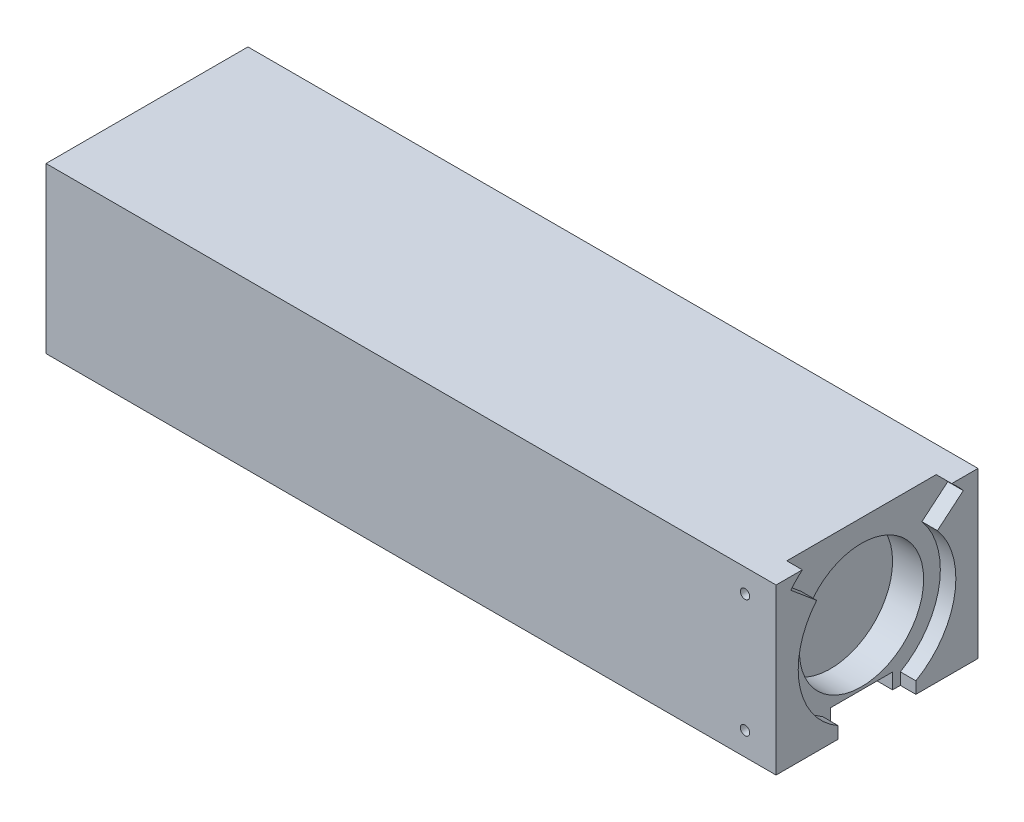
from build123d import *

# Parameters (mm, degrees)
SKETCH_1_W           = 94
SKETCH_1_H           = 26
EXTRUDE_1_DEPTH      = 21.2
SKETCH_1_7_R         = 0.7
CUT_EXTRUDE_1_DEPTH  = 3
SKETCH_2_W           = 77.9
SKETCH_2_H           = 21.4
CUT_EXTRUDE_2_DEPTH  = 19.3
SKETCH_5_W           = 5.5
SKETCH_5_H           = 8
CUT_EXTRUDE_3_DEPTH  = 2
SKETCH_6_W           = 76
SKETCH_6_H           = 24
CUT_EXTRUDE_4_DEPTH  = 3
SKETCH_7_R           = 10.15
SKETCH_7_W           = 10
SKETCH_7_H           = 1.516965414
CUT_EXTRUDE_5_DEPTH  = 2
SKETCH_8_R           = 8
CUT_EXTRUDE_6_DEPTH  = 4
CUT_EXTRUDE_12_DEPTH = 2
SKETCH_10_R          = 0.6
CUT_EXTRUDE_13_DEPTH = 3
CUT_EXTRUDE_START    = -23
SKETCH_10_3_R        = 0.6
CUT_EXTRUDE_14_DEPTH = 3
SKETCH_11_W          = 2.5
SKETCH_11_H          = 11
CUT_EXTRUDE_15_DEPTH = 3
SKETCH_12_R          = 0.3
CUT_EXTRUDE_16_DEPTH = 3
SKETCH_13_W          = 12
SKETCH_13_H          = 3
CUT_EXTRUDE_17_DEPTH = 11


with BuildPart() as part:
    # 草图1 → 凸台-拉伸1 (new body)
    with BuildSketch(Plane(origin=(0, 0, 0), x_dir=(1, 0, 0), z_dir=(0, 1, 0))):
        Rectangle(SKETCH_1_W, SKETCH_1_H)
    extrude(amount=EXTRUDE_1_DEPTH)

    # 草图1<7> → 切除-拉伸1 (cut)
    with BuildSketch(Plane(origin=(0, 0, 0), x_dir=(1, 0, 0), z_dir=(0, 1, 0))):
        with Locations(Location((-44, 10, 0), (0, 0, 270))):
            Circle(SKETCH_1_7_R)
        with Locations(Location((-44, -10, 0), (0, 0, 270))):
            Circle(SKETCH_1_7_R)
        with Locations(Location((44, 10, 0), (0, 0, 270))):
            Circle(SKETCH_1_7_R)
        with Locations(Location((44, -10, 0), (0, 0, 270))):
            Circle(SKETCH_1_7_R)
    extrude(amount=CUT_EXTRUDE_1_DEPTH, mode=Mode.SUBTRACT)

    # 草图2 → 切除-拉伸2 (cut)
    with BuildSketch(Plane.XZ):
        with Locations((1.95, 0)):
            Rectangle(SKETCH_2_W, SKETCH_2_H)
    extrude(amount=-CUT_EXTRUDE_2_DEPTH, mode=Mode.SUBTRACT)

    # 草图5 → 切除-拉伸3 (cut)
    with BuildSketch(Plane.XZ):
        with Locations((-39.75, 0)):
            Rectangle(SKETCH_5_W, SKETCH_5_H)
        with Locations((43.65, 0)):
            Rectangle(SKETCH_5_W, SKETCH_5_H)
    extrude(amount=-CUT_EXTRUDE_3_DEPTH, mode=Mode.SUBTRACT)

    # 草图6 → 切除-拉伸4 (cut)
    with BuildSketch(Plane.XZ):
        with Locations((2, 0)):
            Rectangle(SKETCH_6_W, SKETCH_6_H)
    extrude(amount=-CUT_EXTRUDE_4_DEPTH, mode=Mode.SUBTRACT)

    # 草图7 → 切除-拉伸5 (cut)
    with BuildSketch(Plane(origin=(47, 0, 0), x_dir=(0, 0, -1), z_dir=(1, 0, 0))):
        with Locations((0, 10.35)):
            Circle(SKETCH_7_R)
        with Locations((0, 0.758482707)):
            Rectangle(SKETCH_7_W, SKETCH_7_H)
    extrude(amount=-CUT_EXTRUDE_5_DEPTH, mode=Mode.SUBTRACT)

    # 草图8 → 切除-拉伸6 (cut)
    with BuildSketch(Plane(origin=(45, 0, 0), x_dir=(0, 0, -1), z_dir=(1, 0, 0))):
        with Locations((0, 10.35)):
            Circle(SKETCH_8_R)
    extrude(amount=-CUT_EXTRUDE_6_DEPTH, mode=Mode.SUBTRACT)

    # 草图9 → 切除-拉伸12 (cut)
    with BuildSketch(Plane(origin=(47, 0, 0), x_dir=(0, 0, -1), z_dir=(1, 0, 0))):
        with BuildLine():
            Line((-7.775351098, 16.874294238), (0, 10.35))
            Line((0, 10.35), (7.775351098, 16.874294238))
            ThreePointArc((7.775351098, 16.874294238), (0, 20.5), (-7.775351098, 16.874294238))
        make_face()
        with BuildLine():
            ThreePointArc((-7.775351098, 16.874294238), (0, 20.5), (7.775351098, 16.874294238))
            Line((7.775351098, 16.874294238), (11.107644425, 19.67042034))
            ThreePointArc((11.107644425, 19.67042034), (10.391564404, 20.462635128), (9.619121582, 21.2))
            Line((9.619121582, 21.2), (-9.619121582, 21.2))
            ThreePointArc((-9.619121582, 21.2), (-10.391564404, 20.462635128), (-11.107644425, 19.67042034))
            Line((-11.107644425, 19.67042034), (-7.775351098, 16.874294238))
        make_face()
    extrude(amount=-CUT_EXTRUDE_12_DEPTH, mode=Mode.SUBTRACT)

    # 草图10 → 切除-拉伸13 (cut)
    with BuildSketch(Plane(origin=(0, 0, -13), x_dir=(-1, 0, 0), z_dir=(0, 0, -1))):
        with Locations((-43, 18.2)):
            Circle(SKETCH_10_R)
        with Locations((-43, 3)):
            Circle(SKETCH_10_R)
    extrude(amount=-CUT_EXTRUDE_13_DEPTH, mode=Mode.SUBTRACT)

    # 草图10<3> → 切除-拉伸14 (cut)
    with BuildSketch(Plane(origin=(0, 0, -13), x_dir=(-1, 0, 0), z_dir=(0, 0, -1)).offset(CUT_EXTRUDE_START)):
        with Locations((-43, 18.2)):
            Circle(SKETCH_10_3_R)
        with Locations((-43, 3)):
            Circle(SKETCH_10_3_R)
    extrude(amount=-CUT_EXTRUDE_14_DEPTH, mode=Mode.SUBTRACT)

    # 草图11 → 切除-拉伸15 (cut)
    with BuildSketch(Plane.XZ):
        with Locations((-44.7, 2.65)):
            Rectangle(SKETCH_11_W, SKETCH_11_H)
    extrude(amount=-CUT_EXTRUDE_15_DEPTH, mode=Mode.SUBTRACT)

    # 草图12 → 切除-拉伸16 (cut)
    with BuildSketch(Plane.ZY.offset(47)):
        with Locations((-8.05, 2)):
            Circle(SKETCH_12_R)
        with Locations((8.05, 2)):
            Circle(SKETCH_12_R)
    extrude(amount=-CUT_EXTRUDE_16_DEPTH, mode=Mode.SUBTRACT)

    # 草图13 → 切除-拉伸17 (cut)
    with BuildSketch(Plane.ZY.offset(47)):
        with Locations((0, 1.5)):
            Rectangle(SKETCH_13_W, SKETCH_13_H)
    extrude(amount=-CUT_EXTRUDE_17_DEPTH, mode=Mode.SUBTRACT)


solid = part.part
